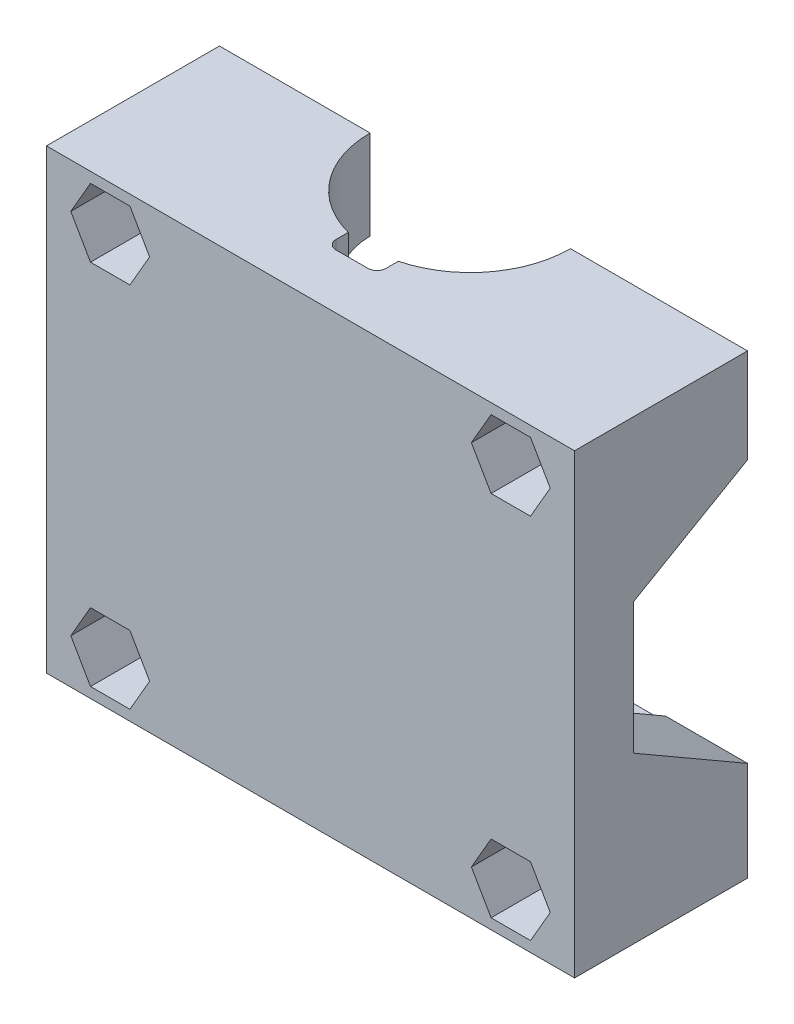
from build123d import *

# Parameters (mm, degrees)
BOSS_EXTRUDE1_DEPTH      = 29
BOSS_EXTRUDE1_DEPTH_BACK = 29
CUT_EXTRUDE1_DEPTH       = 20
CUT_EXTRUDE1_DEPTH_BACK  = 62.202085825
SKETCH2_R                = 15
CUT_EXTRUDE2_DEPTH       = 18
SKETCH4_R                = 3
CUT_EXTRUDE3_DEPTH       = 46.847573609
CUT_EXTRUDE4_DEPTH       = 10


with BuildPart() as part:
    # Sketch1 → Boss-Extrude1 (new, two sides: drawn at the far end of the back side and taken through both)
    with BuildSketch(Plane(origin=(0, 0, 0), x_dir=(0, 0, -1), z_dir=(1, 0, 0)).offset(-BOSS_EXTRUDE1_DEPTH_BACK)):
        Polygon((-44.77382393, -30), (-25.77382393, -30), (-25.77382393, -19.08375673), (-38.27382393, -11.866878365), (-38.27382393, 2.566878365), (-25.77382393, 9.78375673), (-25.77382393, 20.15), (-44.77382393, 20.15), align=None)
    extrude(amount=BOSS_EXTRUDE1_DEPTH + BOSS_EXTRUDE1_DEPTH_BACK)

    # Sketch2 → Cut-Extrude1 (cut, two sides: drawn at the far end of the back side and taken through both)
    with BuildSketch(Plane(origin=(0, 0, 0), x_dir=(0, 0, -1), z_dir=(1, 0, 0)).offset(-CUT_EXTRUDE1_DEPTH_BACK)):
        with Locations((-25.77382393, -4.65)):
            Circle(SKETCH2_R)
    extrude(amount=CUT_EXTRUDE1_DEPTH + CUT_EXTRUDE1_DEPTH_BACK, mode=Mode.SUBTRACT)

    # Sketch3 → Cut-Extrude2 (cut)
    with BuildSketch(Plane(origin=(0, 20.15, 0), x_dir=(1, 0, 0), z_dir=(0, 1, 0))):
        with BuildLine():
            Line((9.55, -25.77382393), (1.3, -25.77382393))
            Line((1.3, -25.77382393), (1.3, -36.424528133))
            ThreePointArc((1.3, -36.424528133), (7.246263565, -32.509920723), (9.55, -25.77382393))
        make_face()
        with BuildLine():
            Line((1.3, -36.424528133), (1.3, -25.77382393))
            Line((1.3, -25.77382393), (-4.2, -25.77382393))
            Line((-4.2, -25.77382393), (-4.2, -36.424528133))
            ThreePointArc((-4.2, -36.424528133), (-1.45, -36.77382393), (1.3, -36.424528133))
        make_face()
        with BuildLine():
            Line((-4.2, -36.424528133), (-4.2, -25.77382393))
            Line((-4.2, -25.77382393), (-12.45, -25.77382393))
            ThreePointArc((-12.45, -25.77382393), (-10.146263565, -32.509920723), (-4.2, -36.424528133))
        make_face()
        with BuildLine():
            Line((1.3, -37.77382393), (1.3, -36.424528133))
            ThreePointArc((1.3, -36.424528133), (-1.45, -36.77382393), (-4.2, -36.424528133))
            Line((-4.2, -36.424528133), (-4.2, -37.77382393))
            ThreePointArc((-4.2, -37.77382393), (-3.907106781, -38.480930712), (-3.2, -38.77382393))
            Line((-3.2, -38.77382393), (0.3, -38.77382393))
            ThreePointArc((0.3, -38.77382393), (1.007106781, -38.480930712), (1.3, -37.77382393))
        make_face()
    extrude(amount=-CUT_EXTRUDE2_DEPTH, mode=Mode.SUBTRACT)

    # Sketch4 → Cut-Extrude3 (cut, through all)
    with BuildSketch(Plane(origin=(0, 0, 25.77382393), x_dir=(-1, 0, 0), z_dir=(0, 0, -1))):
        with Locations((-22, 15.255553499)):
            Circle(SKETCH4_R)
        with Locations((-22, -25.105553499)):
            Circle(SKETCH4_R)
        with Locations((22, -25.105553499)):
            Circle(SKETCH4_R)
        with Locations((22, 15.255553499)):
            Circle(SKETCH4_R)
    extrude(amount=-CUT_EXTRUDE3_DEPTH, mode=Mode.SUBTRACT)

    # Sketch5 → Cut-Extrude4 (cut)
    with BuildSketch(Plane.XY.offset(44.77382393)):
        Polygon((-19.834936491, -21.355553499), (-24.165063509, -21.355553499), (-26.330127019, -25.105553499), (-24.165063509, -28.855553499), (-19.834936491, -28.855553499), (-17.669872981, -25.105553499), align=None)
        Polygon((-19.834936491, 11.505553499), (-17.669872981, 15.255553499), (-19.834936491, 19.005553499), (-24.165063509, 19.005553499), (-26.330127019, 15.255553499), (-24.165063509, 11.505553499), align=None)
        Polygon((17.669872981, 15.255553499), (19.834936491, 11.505553499), (24.165063509, 11.505553499), (26.330127019, 15.255553499), (24.165063509, 19.005553499), (19.834936491, 19.005553499), align=None)
        Polygon((24.165063509, -21.355553499), (19.834936491, -21.355553499), (17.669872981, -25.105553499), (19.834936491, -28.855553499), (24.165063509, -28.855553499), (26.330127019, -25.105553499), align=None)
    extrude(amount=-CUT_EXTRUDE4_DEPTH, mode=Mode.SUBTRACT)


solid = part.part
